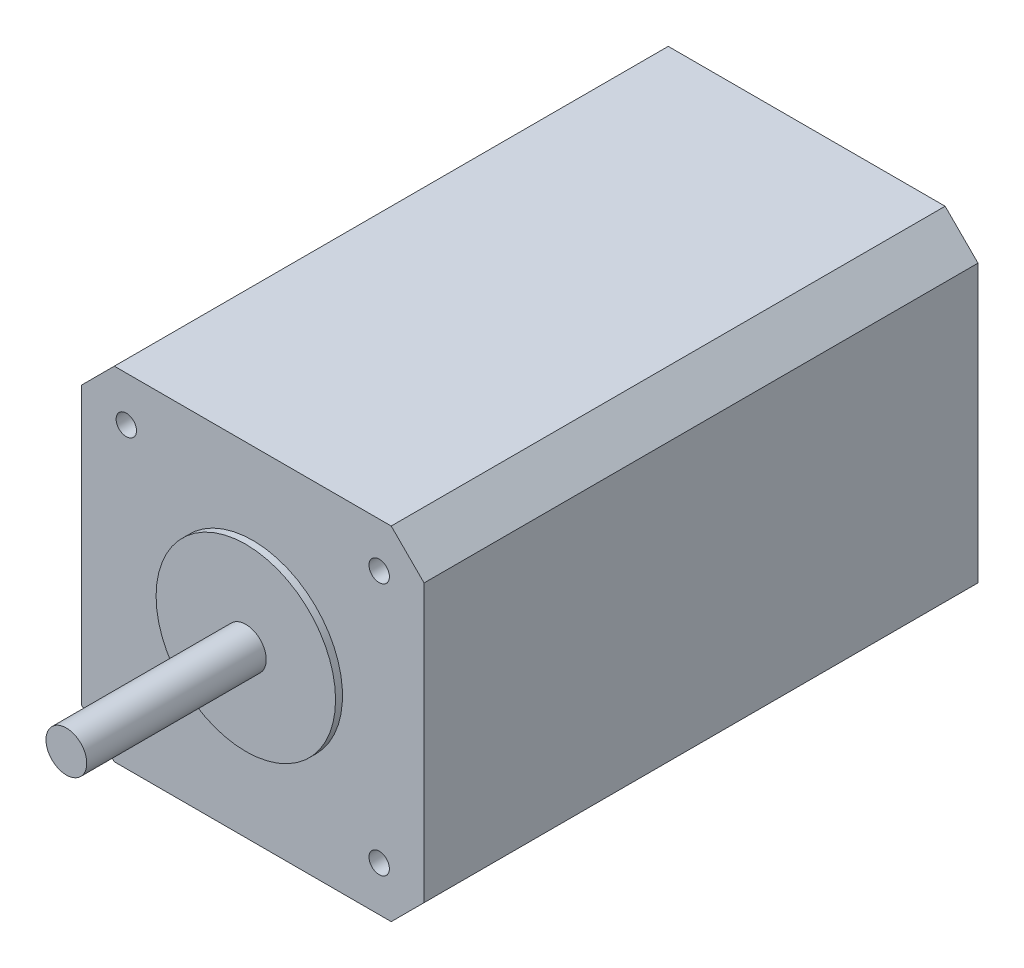
from build123d import *

# Parameters (mm, degrees)
SKETCH1_W               = 42
SKETCH1_H               = 42
BOSS_EXTRUDE1_DEPTH     = 33.95
SKETCH2_R               = 11
BOSS_EXTRUDE2_DEPTH     = 0.85
SKETCH3_R               = 2.5
BOSS_EXTRUDE3_DEPTH     = 22
CUT_EXTRUDE_THIN1_DEPTH = 75.110795435
M3_TAPPED_HOLE1_D       = 2.5
M3_TAPPED_HOLE1_DEPTH   = 4.248924226
M3_TAPPED_HOLE1_TIP     = 0.751075774


with BuildPart() as part:
    # Sketch1 → Boss-Extrude1 (new, symmetric)
    with BuildSketch(Plane.XY):
        Rectangle(SKETCH1_W, SKETCH1_H)
    extrude(amount=BOSS_EXTRUDE1_DEPTH, both=True)

    # Sketch2 → Boss-Extrude2 (add, symmetric)
    with BuildSketch(Plane.XY.offset(33.95)):
        with Locations(Location((0, 0, 0), (0, 0, 180))):
            Circle(SKETCH2_R)
    extrude(amount=BOSS_EXTRUDE2_DEPTH, both=True)

    # Sketch3 → Boss-Extrude3 (add)
    with BuildSketch(Plane.XY.offset(34.8)):
        Circle(SKETCH3_R)
    extrude(amount=BOSS_EXTRUDE3_DEPTH)

    # Sketch4 → Cut-Extrude-Thin1 (cut, through all)
    with BuildSketch(Plane.XY.offset(33.95)):
        Polygon((0, 52.113769773), (52.113769773, 0), (0, -52.113769773), (-52.113769773, 0), align=None)
        Polygon((0, 37.97163415), (37.97163415, 0), (0, -37.97163415), (-37.97163415, 0), align=None, mode=Mode.SUBTRACT)
    extrude(amount=-CUT_EXTRUDE_THIN1_DEPTH, mode=Mode.SUBTRACT)

    # M3 Tapped Hole1
    with Locations(Plane.XY.offset(33.95)):
        with Locations((-15.5, 15.5), (15.5, -15.5), (15.5, 15.5), (-15.5, -15.5)):
            Hole(M3_TAPPED_HOLE1_D / 2, depth=M3_TAPPED_HOLE1_DEPTH)
            with Locations((0, 0, -(M3_TAPPED_HOLE1_DEPTH + M3_TAPPED_HOLE1_TIP / 2))):  # 118° drill point
                Cone(0, M3_TAPPED_HOLE1_D / 2, M3_TAPPED_HOLE1_TIP, mode=Mode.SUBTRACT)


solid = part.part
